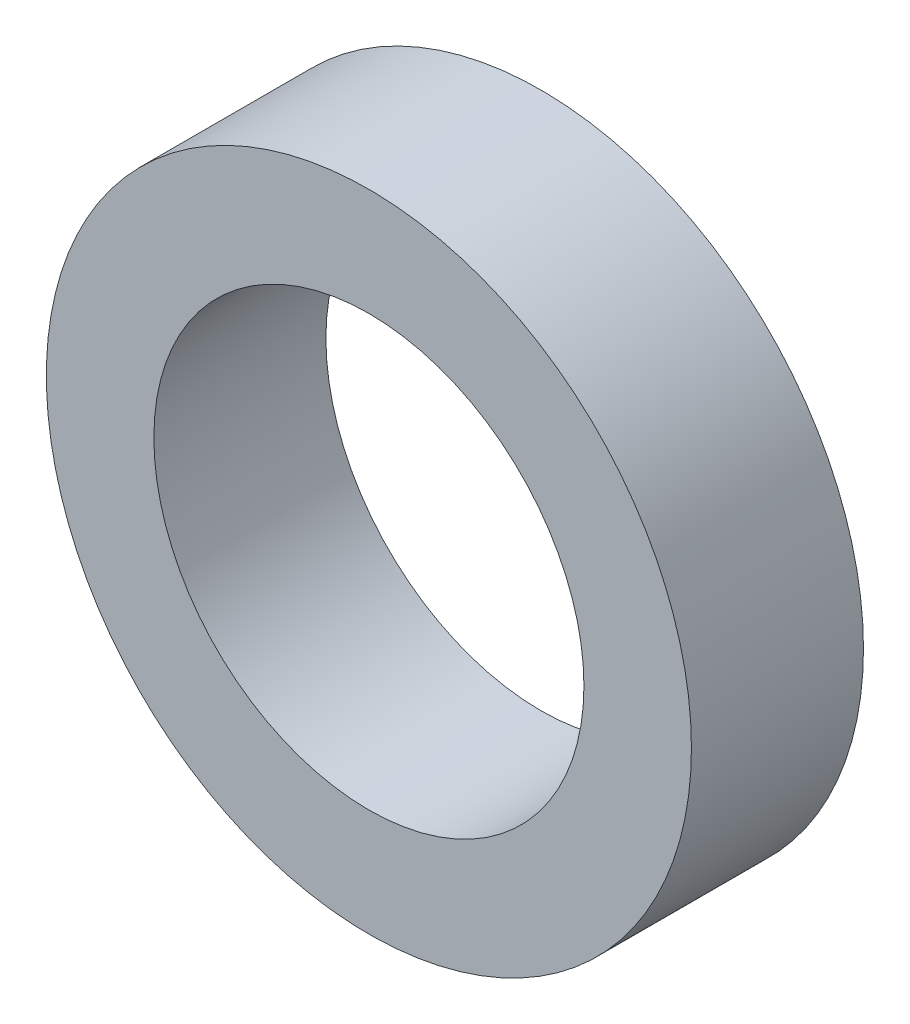
from build123d import *

# Parameters (mm, degrees)
SKETCH1_R           = 7.5
SKETCH1_R_2         = 5
BOSS_EXTRUDE1_DEPTH = 4


with BuildPart() as part:
    # Sketch1 → Boss-Extrude1 (new body)
    with BuildSketch(Plane.XY):
        Circle(SKETCH1_R)
        Circle(SKETCH1_R_2, mode=Mode.SUBTRACT)
    extrude(amount=BOSS_EXTRUDE1_DEPTH)


solid = part.part
